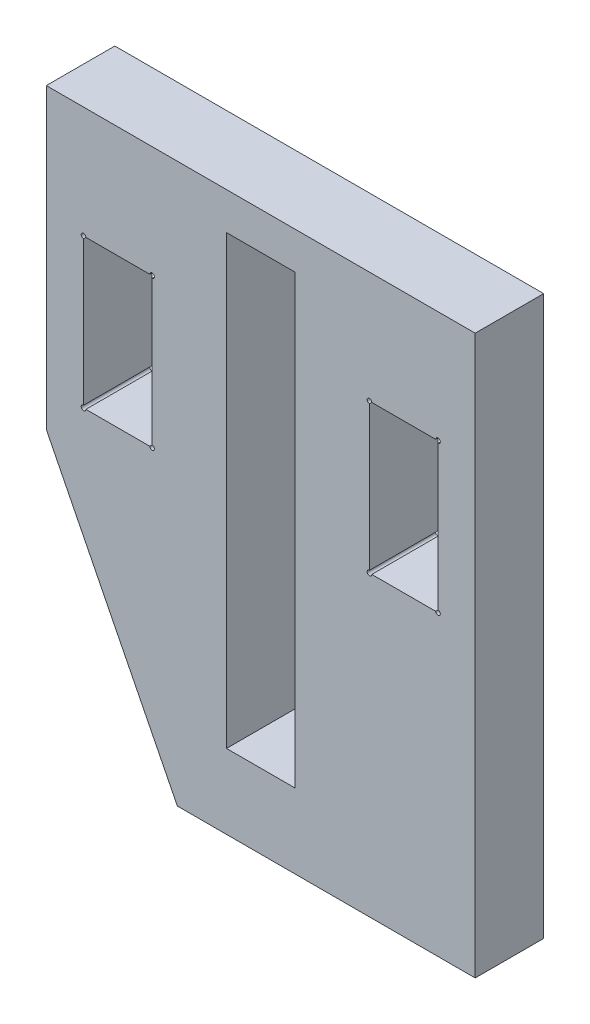
from build123d import *

# Parameters (mm, degrees)
SKETCH1_W           = 5.842
SKETCH1_H           = 12.7
BOSS_EXTRUDE1_DEPTH = 5.842
SKETCH2_R           = 0.1984375
CUT_EXTRUDE1_DEPTH  = 5.842


with BuildPart() as part:
    # Sketch1 → Boss-Extrude1 (new body)
    with BuildSketch(Plane.XY):
        Polygon((2.159, -25.4), (-9.017, -3.175), (-9.017, 22.225), (6.35, 22.225), (12.192, 22.225), (27.559, 22.225), (27.559, -25.4), align=None)
        with Locations((-2.921, 6.35)):
            Rectangle(SKETCH1_W, SKETCH1_H, mode=Mode.SUBTRACT)
        Polygon((12.192, 0), (12.192, -12.7), (12.192, -19.05), (6.35, -19.05), (6.35, -12.7), (6.35, 0), (6.35, 19.05), (12.192, 19.05), align=None, mode=Mode.SUBTRACT)
        with Locations((21.463, 6.35)):
            Rectangle(SKETCH1_W, SKETCH1_H, mode=Mode.SUBTRACT)
    extrude(amount=BOSS_EXTRUDE1_DEPTH)

    # Sketch2 → Cut-Extrude1 (cut)
    with BuildSketch(Plane.XY.offset(5.842)):
        with Locations((-5.842, 12.7)):
            Circle(SKETCH2_R)
        with Locations((0, 12.7)):
            Circle(SKETCH2_R)
        Circle(SKETCH2_R)
        with Locations((-5.842, 0)):
            Circle(SKETCH2_R)
        with Locations((24.384, 0)):
            Circle(SKETCH2_R)
        with Locations((18.542, 0)):
            Circle(SKETCH2_R)
        with Locations((18.542, 12.7)):
            Circle(SKETCH2_R)
        with Locations((24.384, 12.7)):
            Circle(SKETCH2_R)
    extrude(amount=-CUT_EXTRUDE1_DEPTH, mode=Mode.SUBTRACT)


solid = part.part
